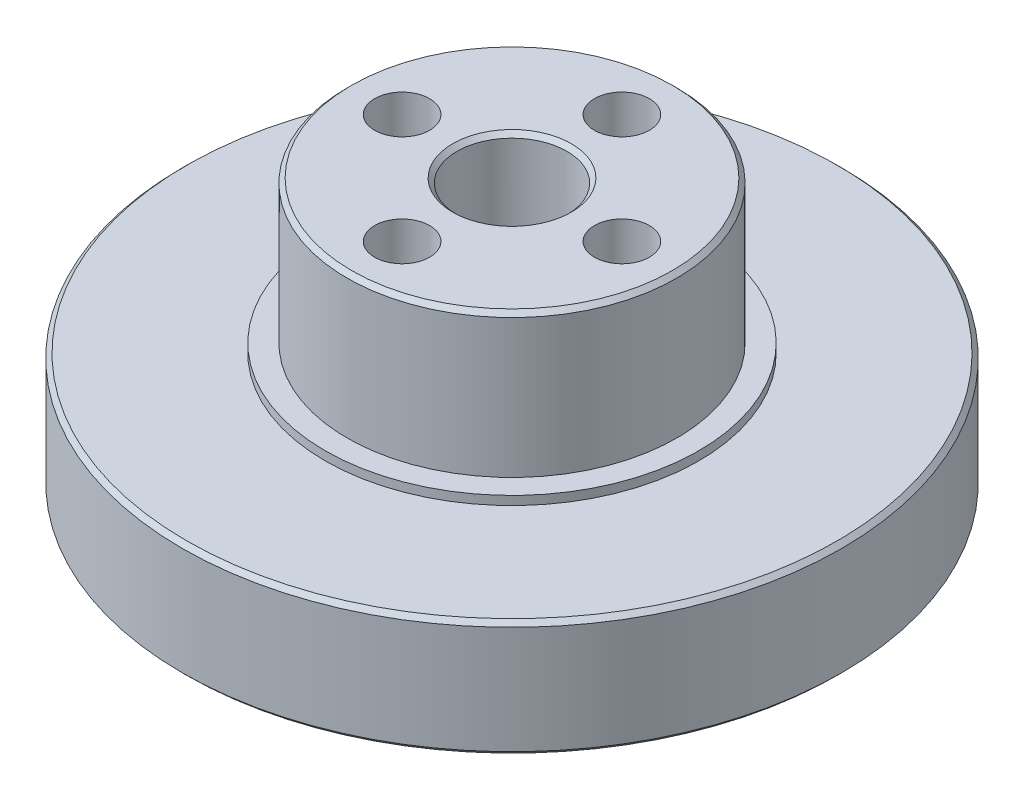
from build123d import *

# Parameters (mm, degrees)
SKETCH_1_R          = 15
SKETCH_1_R_2        = 1.86
EXTRUDE_1_DEPTH     = 3.7
SKETCH_2_R          = 15
EXTRUDE_2_DEPTH     = 1.6
SKETCH_3_R          = 8.5
EXTRUDE_3_DEPTH     = 0.4
SKETCH_4_R          = 7.5
EXTRUDE_4_DEPTH     = 6.5
SKETCH_5_R          = 1.25
SKETCH_5_R_2        = 2.5
CUT_EXTRUDE_1_DEPTH = 7
CHAMFER_1_SIZE      = 0.2
SKETCH_7_R          = 2.5
CUT_EXTRUDE_4_DEPTH = 23.338307904
SKETCH_8_R          = 6
CUT_EXTRUDE_5_DEPTH = 2
CHAMFER_2_SIZE      = 0.5


with BuildPart() as part:
    # 草图1 → 凸台-拉伸1 (new body)
    with BuildSketch(Plane(origin=(0, 0, 0), x_dir=(1, 0, 0), z_dir=(0, 1, 0))):
        with Locations(Location((0, 0, 0), (0, 0, 270))):
            Circle(SKETCH_1_R)
        with Locations(Location((0, 11.525, 0), (0, 0, 270))):
            Circle(SKETCH_1_R_2, mode=Mode.SUBTRACT)
        with Locations(Location((9.980942779, 5.7625, 0), (0, 0, 270))):
            Circle(SKETCH_1_R_2, mode=Mode.SUBTRACT)
        with Locations(Location((9.980942779, -5.7625, 0), (0, 0, 270))):
            Circle(SKETCH_1_R_2, mode=Mode.SUBTRACT)
        with Locations(Location((0, -11.525, 0), (0, 0, 270))):
            Circle(SKETCH_1_R_2, mode=Mode.SUBTRACT)
        with Locations(Location((-9.980942779, -5.7625, 0), (0, 0, 270))):
            Circle(SKETCH_1_R_2, mode=Mode.SUBTRACT)
        with Locations(Location((-9.980942779, 5.7625, 0), (0, 0, 270))):
            Circle(SKETCH_1_R_2, mode=Mode.SUBTRACT)
    extrude(amount=EXTRUDE_1_DEPTH)

    # 草图2 → 凸台-拉伸2 (add)
    with BuildSketch(Plane(origin=(0, 3.7, 0), x_dir=(1, 0, 0), z_dir=(0, 1, 0))):
        with Locations(Location((0, 0, 0), (0, 0, 270))):
            Circle(SKETCH_2_R)
    extrude(amount=EXTRUDE_2_DEPTH)

    # 草图3 → 凸台-拉伸3 (add)
    with BuildSketch(Plane(origin=(0, 5.3, 0), x_dir=(1, 0, 0), z_dir=(0, 1, 0))):
        with Locations(Location((0, 0, 0), (0, 0, 270))):
            Circle(SKETCH_3_R)
    extrude(amount=EXTRUDE_3_DEPTH)

    # 草图4 → 凸台-拉伸4 (add)
    with BuildSketch(Plane(origin=(0, 5.7, 0), x_dir=(1, 0, 0), z_dir=(0, 1, 0))):
        with Locations(Location((0, 0, 0), (0, 0, 90))):
            Circle(SKETCH_4_R)
    extrude(amount=EXTRUDE_4_DEPTH)

    # 草图5 → 切除-拉伸1 (cut)
    with BuildSketch(Plane(origin=(0, 12.2, 0), x_dir=(1, 0, 0), z_dir=(0, 1, 0))):
        with Locations(Location((0, 5, 0), (0, 0, 270))):
            Circle(SKETCH_5_R)
        with Locations(Location((5, 0, 0), (0, 0, 270))):
            Circle(SKETCH_5_R)
        with Locations(Location((0, -5, 0), (0, 0, 270))):
            Circle(SKETCH_5_R)
        with Locations(Location((-5, 0, 0), (0, 0, 270))):
            Circle(SKETCH_5_R)
        with Locations(Location((0, 0, 0), (0, 0, 270))):
            Circle(SKETCH_5_R_2)
    extrude(amount=-CUT_EXTRUDE_1_DEPTH, mode=Mode.SUBTRACT)

    # 倒角1
    chamfer_1_edges = [part.edges().sort_by_distance(p)[0] for p in [
        (9.980942779, 0, 3.9025),
        (0, 0, 9.665),
        (0, 0, -15),
        (-9.980942779, 0, 3.9025),
        (-9.980942779, 0, -7.6225),
        (0, 5.3, -15),
        (0, 12.2, 7.5),
        (0, 0, -13.385),
        (0, 12.2, -2.5),
        (9.980942779, 0, -7.6225),
    ]]
    chamfer(chamfer_1_edges, length=CHAMFER_1_SIZE)

    # 草图7 → 切除-拉伸4 (cut, through all)
    with BuildSketch(Plane(origin=(0, 5.2, 0), x_dir=(1, 0, 0), z_dir=(0, 1, 0))):
        with Locations(Location((0, 0, 0), (0, 0, 270))):
            Circle(SKETCH_7_R)
    extrude(amount=-CUT_EXTRUDE_4_DEPTH, mode=Mode.SUBTRACT)

    # 草图8 → 切除-拉伸5 (cut)
    with BuildSketch(Plane(origin=(0, 0, 0), x_dir=(-1, 0, 0), z_dir=(0, -1, 0))):
        with Locations(Location((0, 0, 0), (0, 0, 90))):
            Circle(SKETCH_8_R)
    extrude(amount=-CUT_EXTRUDE_5_DEPTH, mode=Mode.SUBTRACT)

    # 倒角2
    chamfer_2_edges = [part.edges().sort_by_distance(p)[0] for p in [
        (0, 0, 6),
        (0, 2, 6),
        (0, 2, -2.5),
    ]]
    chamfer(chamfer_2_edges, length=CHAMFER_2_SIZE)


solid = part.part
